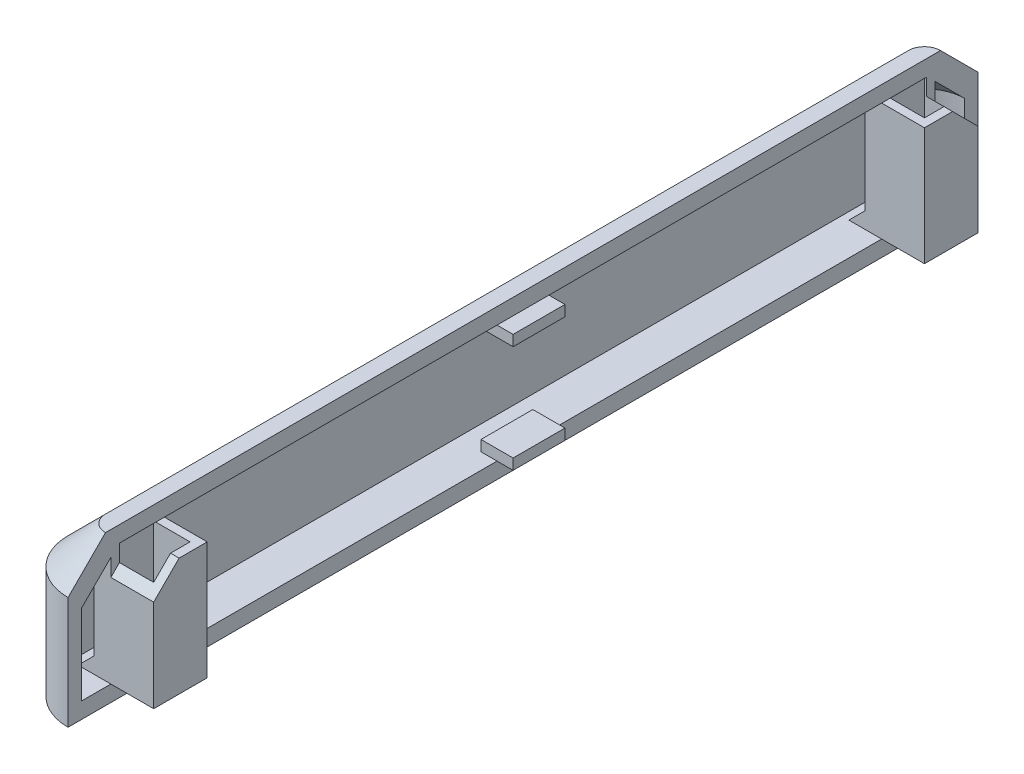
from build123d import *

# Parameters (mm, degrees)
BOSS_EXTRUDE1_DEPTH      = 28
SHELL1_T                 = -2.5
SHELL1_THICKNESS_2_DEPTH = 0.5
SHELL1_THICKNESS_3_DEPTH = 0.5
CHAMFER1_SIZE            = 7
BOSS_EXTRUDE2_REACH      = 164.25
SKETCH6_W                = 11.122019094
SKETCH6_H                = 10
SKETCH6_W_2              = 6.8
SKETCH6_H_2              = 6.8
CHAMFER2_SIZE            = 3
CUT_EXTRUDE2_START       = -8
CUT_EXTRUDE2_DEPTH       = 8
BOSS_EXTRUDE3_DEPTH      = 3
BOSS_EXTRUDE3_DEPTH_BACK = 3
SKETCH8_W                = 9.684827103
SKETCH8_H                = 2


with BuildPart() as part:
    # Sketch3 → Boss-Extrude1 (new body)
    with BuildSketch(Plane(origin=(0, 0, 0), x_dir=(1, 0, 0), z_dir=(0, 1, 0))):
        with BuildLine():
            Line((0, 160), (0, -10))
            ThreePointArc((0, -10), (-7.071067812, -7.071067812), (-10, 0))
            Line((-10, 0), (-10, 150))
            ThreePointArc((-10, 150), (-7.071067812, 157.071067812), (0, 160))
        make_face()
    extrude(amount=BOSS_EXTRUDE1_DEPTH)

    # Shell1
    shell1_openings = [part.faces().sort_by_distance(p)[0] for p in [
        (0, 14, -75),
    ]]
    offset(amount=SHELL1_T, openings=shell1_openings, kind=Kind.INTERSECTION)

    # Shell1 thickness 2 face (on inner face of the shell) → Shell1 thickness 2 (add)
    with BuildSketch(Plane(origin=(-3.708717972, 2.5, -75), x_dir=(0, 0, -1), z_dir=(0, -1, 0))):
        with BuildLine():
            Line((-82.5, 3.708717972), (82.5, 3.708717972))
            ThreePointArc((82.5, 3.708717972), (80.303300859, -1.594582887), (75, -3.791282028))
            Line((75, -3.791282028), (-75, -3.791282028))
            ThreePointArc((-75, -3.791282028), (-80.303300859, -1.594582887), (-82.5, 3.708717972))
        make_face()
    extrude(amount=-SHELL1_THICKNESS_2_DEPTH)

    # Shell1 thickness 3 face (on inner face of the shell) → Shell1 thickness 3 (add)
    with BuildSketch(Plane(origin=(-3.708717972, 25.5, -75), x_dir=(0, 0, 1), z_dir=(0, 1, 0))):
        with BuildLine():
            Line((-82.5, 3.708717972), (82.5, 3.708717972))
            ThreePointArc((82.5, 3.708717972), (80.303300859, -1.594582887), (75, -3.791282028))
            Line((75, -3.791282028), (-75, -3.791282028))
            ThreePointArc((-75, -3.791282028), (-80.303300859, -1.594582887), (-82.5, 3.708717972))
        make_face()
    extrude(amount=-SHELL1_THICKNESS_3_DEPTH)

    # Chamfer1
    chamfer1_edges = [part.edges().sort_by_distance(p)[0] for p in [
        (-7.071067812, 28, 7.071067812),
        (-5.303300859, 25, -155.303300859),
        (-7.5, 25, -75),
        (-5.303300859, 25, 5.303300859),
        (-7.071067812, 28, -157.071067812),
        (-10, 28, -75),
    ]]
    chamfer(chamfer1_edges, length=CHAMFER1_SIZE)

    # Boss-Extrude2: up to this face of the body (flat: up to its plane)
    boss_extrude2_end = Plane(part.part.faces().sort_by_distance((-0.249803145, 25, -75))[0])
    # Sketch6 → Boss-Extrude2 (add, up to the picked face)
    with BuildSketch(Plane(origin=(0, 3, 0), x_dir=(1, 0, 0), z_dir=(0, 1, 0)), mode=Mode.PRIVATE) as boss_extrude2_sk1:
        with Locations((2.438990453, 147)):
            Rectangle(SKETCH6_W, SKETCH6_H)
        with Locations((3, 147)):
            Rectangle(SKETCH6_W_2, SKETCH6_H_2, mode=Mode.SUBTRACT)
    boss_extrude2_tool1 = split(extrude(boss_extrude2_sk1.sketch, amount=BOSS_EXTRUDE2_REACH, mode=Mode.PRIVATE), bisect_by=boss_extrude2_end, keep=Keep.BOTH, mode=Mode.PRIVATE)
    # Sketch6 → Boss-Extrude2 (add, up to the picked face)
    with BuildSketch(Plane(origin=(0, 3, 0), x_dir=(1, 0, 0), z_dir=(0, 1, 0)), mode=Mode.PRIVATE) as boss_extrude2_sk2:
        with Locations((2.438990453, 3)):
            Rectangle(SKETCH6_W, SKETCH6_H)
        with Locations((3, 3)):
            Rectangle(SKETCH6_W_2, SKETCH6_H_2, mode=Mode.SUBTRACT)
    boss_extrude2_tool2 = split(extrude(boss_extrude2_sk2.sketch, amount=BOSS_EXTRUDE2_REACH, mode=Mode.PRIVATE), bisect_by=boss_extrude2_end, keep=Keep.BOTH, mode=Mode.PRIVATE)
    add(boss_extrude2_tool1.solids().sort_by(Axis((2.43899, 3, -151.850434), (0, 1, 0)))[0])
    add(boss_extrude2_tool2.solids().sort_by(Axis((-2.972453, 3, -3), (0, 1, 0)))[0])

    # Chamfer2
    chamfer2_edges = [part.edges().sort_by_distance(p)[0] for p in [
        (-3.122019094, 3, -3),
        (-3.122019094, 3, -147),
    ]]
    chamfer(chamfer2_edges, length=CHAMFER2_SIZE)

    # Sketch7 → Cut-Extrude2 (cut)
    with BuildSketch(Plane(origin=(8, 0, 0), x_dir=(0, 0, -1), z_dir=(1, 0, 0)).offset(CUT_EXTRUDE2_START)):
        Polygon((-3.29028529, 29.773150155), (-3.29028529, 18.960661134), (4.456137204, 26.707083629), align=None)
        Polygon((145.543862796, 26.707083629), (153.29028529, 29.773150155), (153.29028529, 18.960661134), align=None)
    extrude(amount=CUT_EXTRUDE2_DEPTH, mode=Mode.SUBTRACT)

    # Sketch8 → Boss-Extrude3 (add, two sides: drawn at the far end of the back side and taken through both)
    with BuildSketch(Plane(origin=(0, 0, 0), x_dir=(0, 0, -1), z_dir=(1, 0, 0)).offset(-BOSS_EXTRUDE3_DEPTH_BACK)):
        with Locations((74.990759453, 4)):
            Rectangle(SKETCH8_W, SKETCH8_H)
        with Locations((74.990759453, 24)):
            Rectangle(SKETCH8_W, SKETCH8_H)
    extrude(amount=BOSS_EXTRUDE3_DEPTH + BOSS_EXTRUDE3_DEPTH_BACK)


solid = part.part
